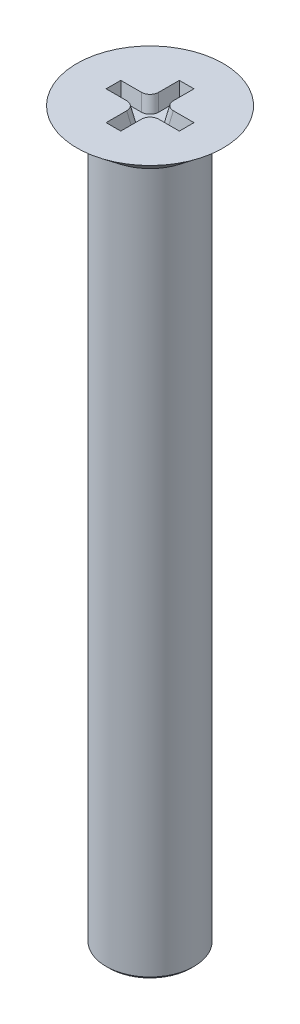
from build123d import *

# Parameters (mm, degrees)
SKETCH_2_R                    = 1.5
EXTRUDE_1_DEPTH               = 24
CHAMFER_1_SIZE                = 0.1
SKETCH_3_W                    = 2.5
SKETCH_3_H                    = 0.5
CUT_EXTRUDE_1_DEPTH           = 0.5
CUT_EXTRUDE_1_DRAFT           = -10
SKETCH_3_W_2                  = 0.5
SKETCH_3_H_2                  = 2.5
CUT_EXTRUDE_1_PROFILE_2_DEPTH = 0.5
CUT_EXTRUDE_1_PROFILE_2_DRAFT = -10
FILLET_1_R                    = 0.3


with BuildPart() as part:
    # 草图1 → 旋转1 (revolve)
    with BuildSketch(Plane.XY, mode=Mode.PRIVATE) as revolve_1_sk:
        Polygon((0, 0), (2.5, 0), (1.5, -0.8), (0, -0.8), align=None)
    revolve(revolve_1_sk.sketch.rotate(Axis((0, -0.8, 0), (0, 1, 0)), 90), axis=Axis((0, -0.8, 0), (0, 1, 0)))

    # 草图2 → 凸台-拉伸1 (add)
    with BuildSketch(Plane.XZ.offset(0.8)):
        with Locations(Location((0, 0, 0), (0, 0, 270))):
            Circle(SKETCH_2_R)
    extrude(amount=EXTRUDE_1_DEPTH)

    # 倒角1
    chamfer_1_edges = [part.edges().sort_by_distance(p)[0] for p in [
        (0, -24.8, 1.5),
    ]]
    chamfer(chamfer_1_edges, length=CHAMFER_1_SIZE)


with BuildPart() as cut_extrude_1_tool:
    # 草图3 → 切除-拉伸1 (with draft: the straight prism first)
    with BuildSketch(Plane(origin=(0, 0, 0), x_dir=(1, 0, 0), z_dir=(0, 1, 0))):
        Rectangle(SKETCH_3_W, SKETCH_3_H)
    extrude(amount=-CUT_EXTRUDE_1_DEPTH)
    # 切除-拉伸1: the draft: its side faces are tilted about the plane it starts from
    cut_extrude_1_sides = [cut_extrude_1_tool.faces().sort_by_distance(p)[0] for p in [
        (0, -0.25, 0.25),
        (1.25, -0.25, 0),
        (0, -0.25, -0.25),
        (-1.25, -0.25, 0),
    ]]
    draft(cut_extrude_1_sides, Plane(origin=(0, 0, 0), x_dir=(1, 0, 0), z_dir=(0, 1, 0)), CUT_EXTRUDE_1_DRAFT)


with BuildPart() as part_1:
    add(part.part)

    # 切除-拉伸1: cut by cut_extrude_1_tool
    add(cut_extrude_1_tool.part, mode=Mode.SUBTRACT)


with BuildPart() as cut_extrude_1_profile_2_tool:
    # 草图3 → 切除-拉伸1 profile 2 (with draft: the straight prism first)
    with BuildSketch(Plane(origin=(0, 0, 0), x_dir=(1, 0, 0), z_dir=(0, 1, 0))):
        Rectangle(SKETCH_3_W_2, SKETCH_3_H_2)
    extrude(amount=-CUT_EXTRUDE_1_PROFILE_2_DEPTH)
    # 切除-拉伸1 profile 2: the draft: its side faces are tilted about the plane it starts from
    cut_extrude_1_profile_2_sides = [cut_extrude_1_profile_2_tool.faces().sort_by_distance(p)[0] for p in [
        (-0.25, -0.25, 0),
        (0, -0.25, 1.25),
        (0.25, -0.25, 0),
        (0, -0.25, -1.25),
    ]]
    draft(cut_extrude_1_profile_2_sides, Plane(origin=(0, 0, 0), x_dir=(1, 0, 0), z_dir=(0, 1, 0)), CUT_EXTRUDE_1_PROFILE_2_DRAFT)


with BuildPart() as part_2:
    add(part_1.part)

    # 切除-拉伸1 profile 2: cut by cut_extrude_1_profile_2_tool
    add(cut_extrude_1_profile_2_tool.part, mode=Mode.SUBTRACT)

    # 圆角1
    fillet_1_edges = [part_2.edges().sort_by_distance(p)[0] for p in [
        (0.205918255, -0.25, -0.205918255),
        (0.205918255, -0.25, 0.205918255),
        (-0.205918255, -0.25, 0.205918255),
        (-0.205918255, -0.25, -0.205918255),
    ]]
    fillet(fillet_1_edges, radius=FILLET_1_R)


solid = part_2.part
